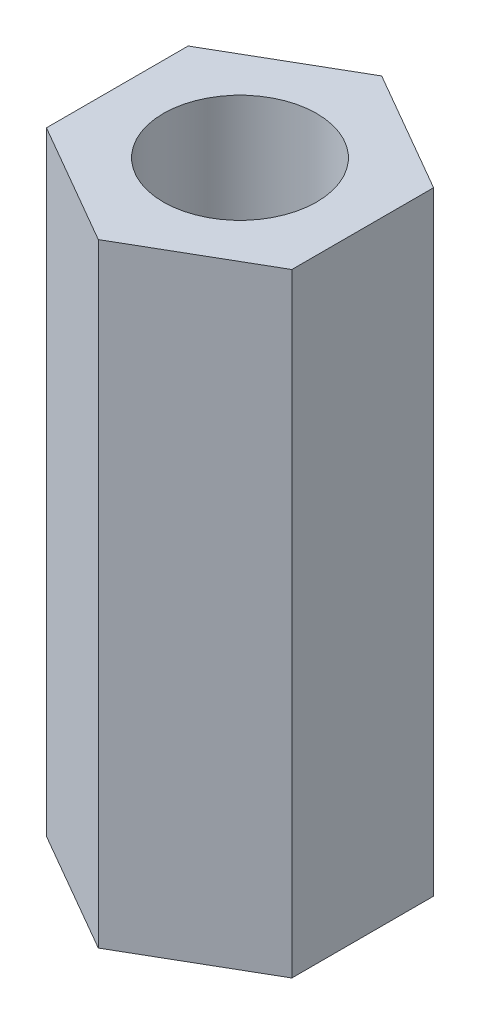
from build123d import *

# Parameters (mm, degrees)
SKETCH_1_R      = 2.5
EXTRUDE_1_DEPTH = 20


with BuildPart() as part:
    # 草图1 → 凸台-拉伸1 (new body)
    with BuildSketch(Plane(origin=(0, 0, 0), x_dir=(1, 0, 0), z_dir=(0, 1, 0))):
        Polygon((0, 4.618802154), (-4, 2.309401077), (-4, -2.309401077), (0, -4.618802154), (4, -2.309401077), (4, 2.309401077), align=None)
        with Locations(Location((0, 0, 0), (0, 0, 270))):
            Circle(SKETCH_1_R, mode=Mode.SUBTRACT)
    extrude(amount=EXTRUDE_1_DEPTH)


solid = part.part
